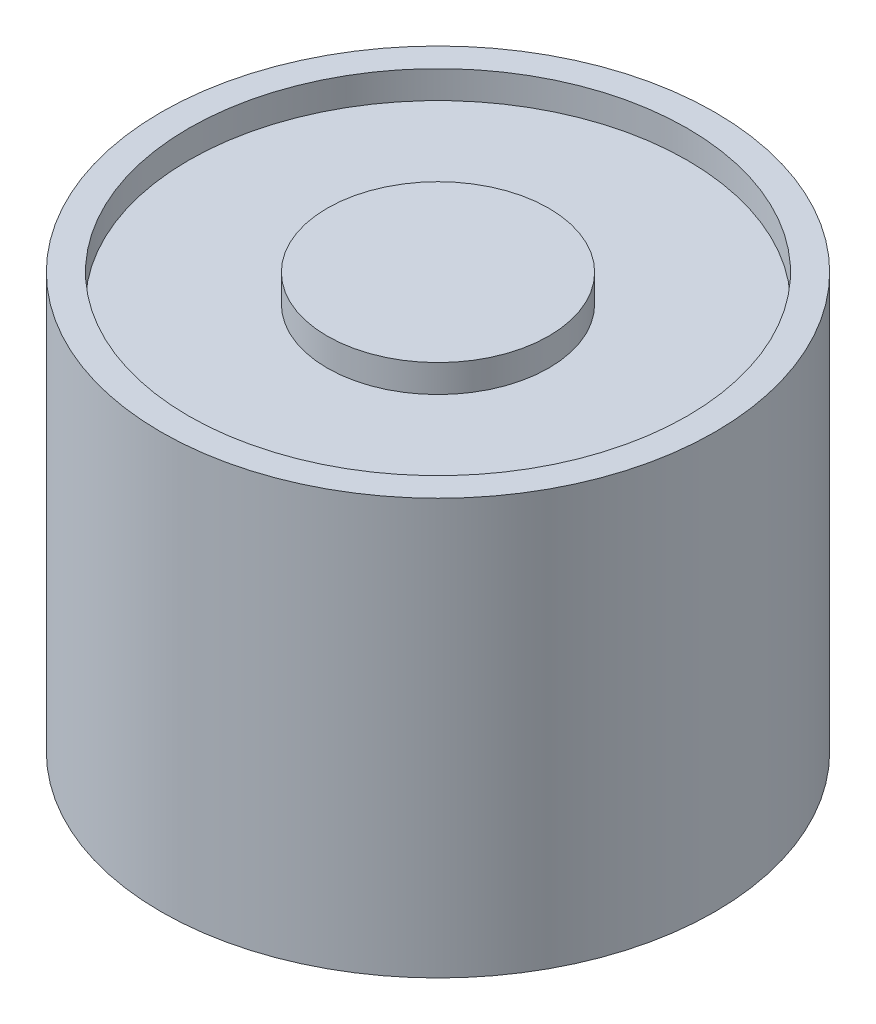
from build123d import *

# Parameters (mm, degrees)
SKETCH1_R                = 10
BOSS_EXTRUDE1_DEPTH      = 15
SKETCH2_R                = 9
SKETCH2_R_2              = 4
CUT_EXTRUDE1_DEPTH       = 1
M3_CLEARANCE_HOLE1_D     = 3.2
M3_CLEARANCE_HOLE1_DEPTH = 5
M3_CLEARANCE_HOLE1_TIP   = 0.96137699


with BuildPart() as part:
    # Sketch1 → Boss-Extrude1 (new body)
    with BuildSketch(Plane(origin=(0, 0, 0), x_dir=(1, 0, 0), z_dir=(0, 1, 0))):
        with Locations(Location((0, 0, 0), (0, 0, 270))):
            Circle(SKETCH1_R)
    extrude(amount=BOSS_EXTRUDE1_DEPTH)

    # Sketch2 → Cut-Extrude1 (cut)
    with BuildSketch(Plane(origin=(0, 15, 0), x_dir=(1, 0, 0), z_dir=(0, 1, 0))):
        with Locations(Location((0, 0, 0), (0, 0, 270))):
            Circle(SKETCH2_R)
        with Locations(Location((0, 0, 0), (0, 0, 270))):
            Circle(SKETCH2_R_2, mode=Mode.SUBTRACT)
    extrude(amount=-CUT_EXTRUDE1_DEPTH, mode=Mode.SUBTRACT)

    # M3 Clearance Hole1
    with Locations(Plane(origin=(0, 0, 0), x_dir=(-1, 0, 0), z_dir=(0, -1, 0))):
        with Locations((0, 0)):
            Hole(M3_CLEARANCE_HOLE1_D / 2, depth=M3_CLEARANCE_HOLE1_DEPTH)
            with Locations((0, 0, -(M3_CLEARANCE_HOLE1_DEPTH + M3_CLEARANCE_HOLE1_TIP / 2))):  # 118° drill point
                Cone(0, M3_CLEARANCE_HOLE1_D / 2, M3_CLEARANCE_HOLE1_TIP, mode=Mode.SUBTRACT)


solid = part.part
